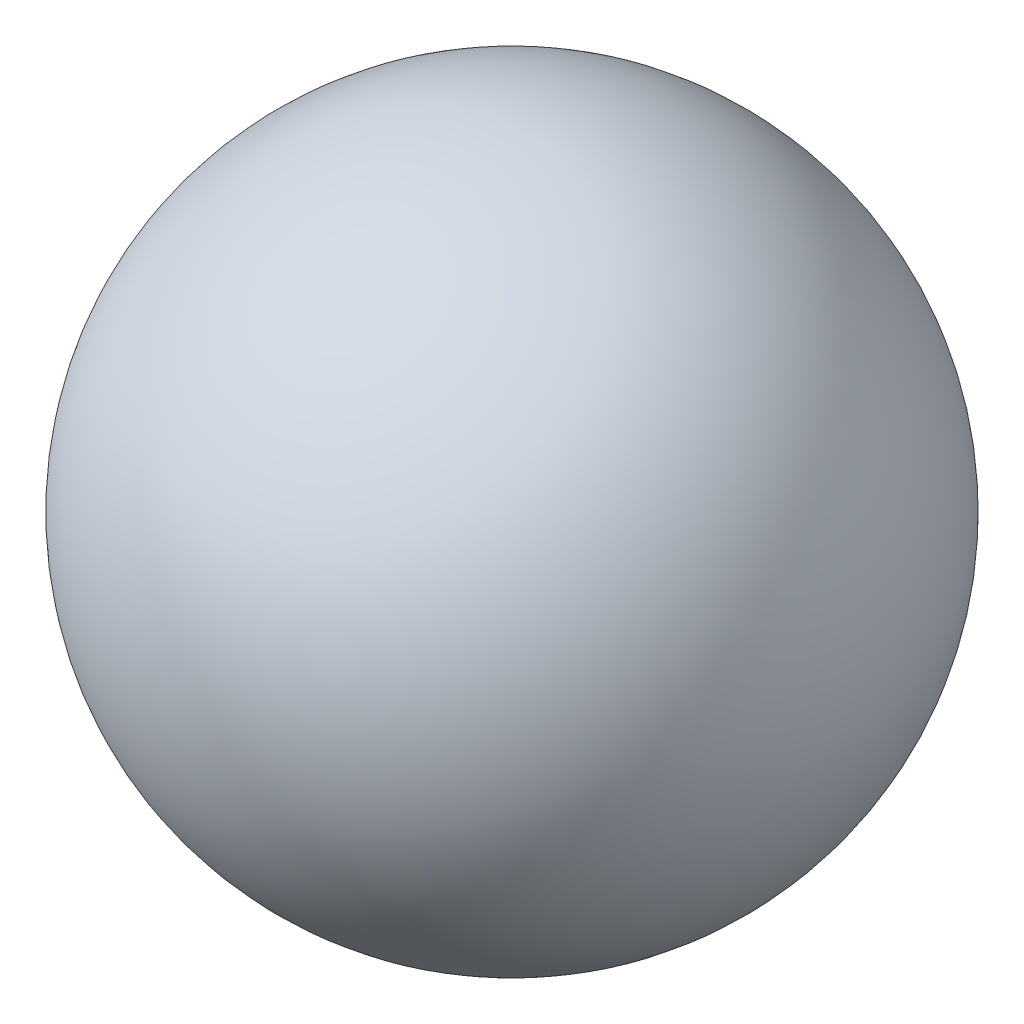
from build123d import *


with BuildPart() as part:
    # Sketch1 → Revolve1 (revolve)
    with BuildSketch(Plane(origin=(0, 0, 0), x_dir=(0, 0, -1), z_dir=(1, 0, 0))):
        with BuildLine():
            Line((0, 22.225), (0, -22.225))
            ThreePointArc((0, -22.225), (22.225, 0), (0, 22.225))
        make_face()
    revolve(axis=Axis((0, 22.225, 0), (0, -1, 0)))


solid = part.part
